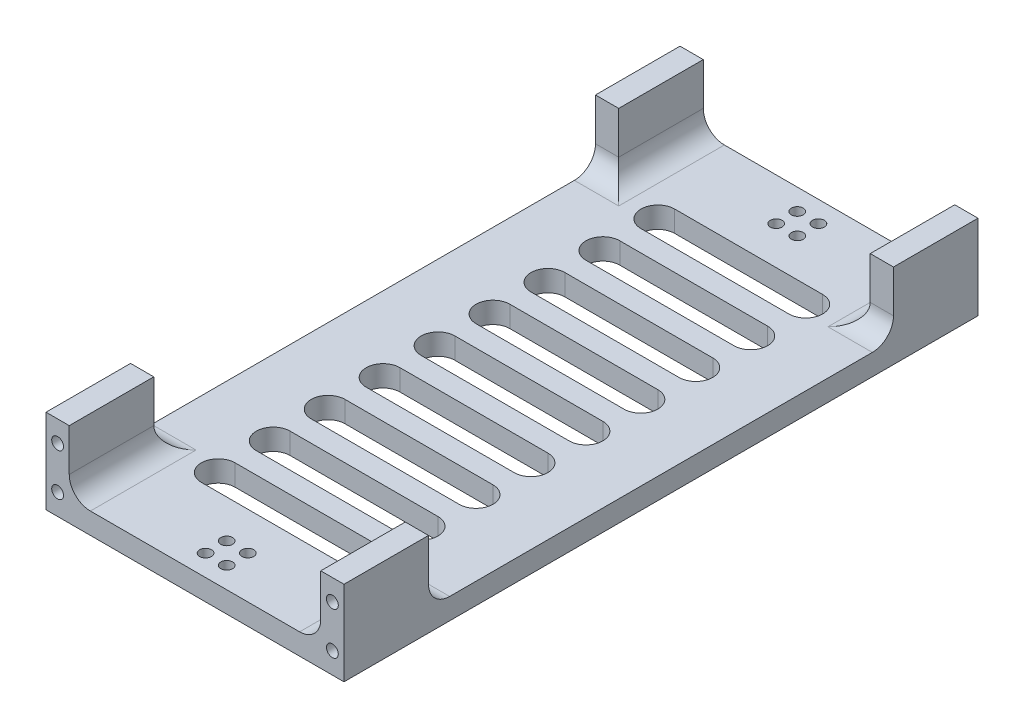
from build123d import *

# Parameters (mm, degrees)
SKETCH1_W               = 70.5
SKETCH1_H               = 150
BOSS_EXTRUDE1_DEPTH     = 20
SKETCH2_R               = 1.4
CUT_EXTRUDE1_DEPTH      = 7
SKETCH3_W               = 59.5
SKETCH3_H               = 15
CUT_EXTRUDE2_DEPTH      = 156.378771072
CUT_EXTRUDE5_DEPTH      = 102.242283657
CUT_EXTRUDE5_DEPTH_BACK = 102.242283657
SKETCH7_W               = 110
SKETCH7_H               = 15
FILLET1_R               = 5
SKETCH5_R               = 1.4
CUT_EXTRUDE3_DEPTH      = 85.217352725
CUT_EXTRUDE4_DEPTH      = 85.217352725
LPATTERN1_COUNT         = 5
LPATTERN1_PITCH         = 13
LPATTERN1_COL_COUNT     = 5
LPATTERN1_COL_PITCH     = 13


with BuildPart() as part:
    # Sketch1 → Boss-Extrude1 (new body)
    with BuildSketch(Plane(origin=(0, 0, 0), x_dir=(1, 0, 0), z_dir=(0, 1, 0))):
        Rectangle(SKETCH1_W, SKETCH1_H)
    extrude(amount=BOSS_EXTRUDE1_DEPTH)

    # Sketch2 → Cut-Extrude1 (cut)
    with BuildSketch(Plane(origin=(0, 0, -75), x_dir=(-1, 0, 0), z_dir=(0, 0, -1))):
        with Locations((-32.5, 15)):
            Circle(SKETCH2_R)
        with Locations(Location((-32.5, 5, 0), (0, 0, 180))):
            Circle(SKETCH2_R)
        with Locations((32.5, 5)):
            Circle(SKETCH2_R)
        with Locations(Location((32.5, 15, 0), (0, 0, 180))):
            Circle(SKETCH2_R)
    cut_extrude1 = extrude(amount=-CUT_EXTRUDE1_DEPTH, mode=Mode.SUBTRACT)

    # Sketch3 → Cut-Extrude2 (cut, through all)
    with BuildSketch(Plane.XY.offset(75)):
        with Locations((0, 12.5)):
            Rectangle(SKETCH3_W, SKETCH3_H)
    extrude(amount=-CUT_EXTRUDE2_DEPTH, mode=Mode.SUBTRACT)

    # Sketch7 → Cut-Extrude5 (cut, two sides: drawn at the far end of the back side and taken through both)
    with BuildSketch(Plane.ZY.offset(-29.75).offset(-CUT_EXTRUDE5_DEPTH_BACK)):
        with Locations((0, 12.5)):
            Rectangle(SKETCH7_W, SKETCH7_H)
    extrude(amount=CUT_EXTRUDE5_DEPTH + CUT_EXTRUDE5_DEPTH_BACK, mode=Mode.SUBTRACT)

    # Fillet1
    fillet1_edges = [part.edges().sort_by_distance(p)[0] for p in [
        (-29.75, 5, -65),
        (29.75, 5, -65),
        (29.75, 5, 65),
        (-29.75, 5, 65),
        (-32.5, 5, 55),
        (32.5, 5, 55),
        (-32.5, 5, -55),
        (32.5, 5, -55),
    ]]
    fillet(fillet1_edges, radius=FILLET1_R)

    # Sketch5 → Cut-Extrude3 (cut, through all)
    with BuildSketch(Plane(origin=(0, 5, 0), x_dir=(1, 0, 0), z_dir=(0, 1, 0))):
        with Locations(Location((-2.5, -70, 0), (0, 0, 270))):
            Circle(SKETCH5_R)
        with Locations(Location((2.5, -70, 0), (0, 0, 90))):
            Circle(SKETCH5_R)
        with Locations(Location((2.5, -65, 0), (0, 0, 270))):
            Circle(SKETCH5_R)
        with Locations(Location((-2.5, -65, 0), (0, 0, 90))):
            Circle(SKETCH5_R)
    cut_extrude3 = extrude(amount=-CUT_EXTRUDE3_DEPTH, mode=Mode.SUBTRACT)

    # Mirror1: Cut-Extrude1, Cut-Extrude3 across plane
    add(cut_extrude1.mirror(Plane.XY), mode=Mode.SUBTRACT)
    add(cut_extrude3.mirror(Plane.XY), mode=Mode.SUBTRACT)

    # Sketch6 → Cut-Extrude4 (cut, through all)
    with BuildSketch(Plane(origin=(0, 5, 0), x_dir=(1, 0, 0), z_dir=(0, 1, 0))):
        with BuildLine():
            Line((-17.5, 4), (17.5, 4))
            ThreePointArc((17.5, 4), (21.5, 0), (17.5, -4))
            Line((17.5, -4), (-17.5, -4))
            ThreePointArc((-17.5, -4), (-21.5, 0), (-17.5, 4))
        make_face()
    cut_extrude4 = extrude(amount=-CUT_EXTRUDE4_DEPTH, mode=Mode.SUBTRACT)

    # LPattern1: Cut-Extrude4 ×5
    with Locations(*[(0, 0, i * LPATTERN1_PITCH) for i in range(1, LPATTERN1_COUNT)]):
        add(cut_extrude4, mode=Mode.SUBTRACT)

    # LPattern1 col: Cut-Extrude4 ×5
    with Locations(*[(0, 0, -i * LPATTERN1_COL_PITCH) for i in range(1, LPATTERN1_COL_COUNT)]):
        add(cut_extrude4, mode=Mode.SUBTRACT)


solid = part.part
